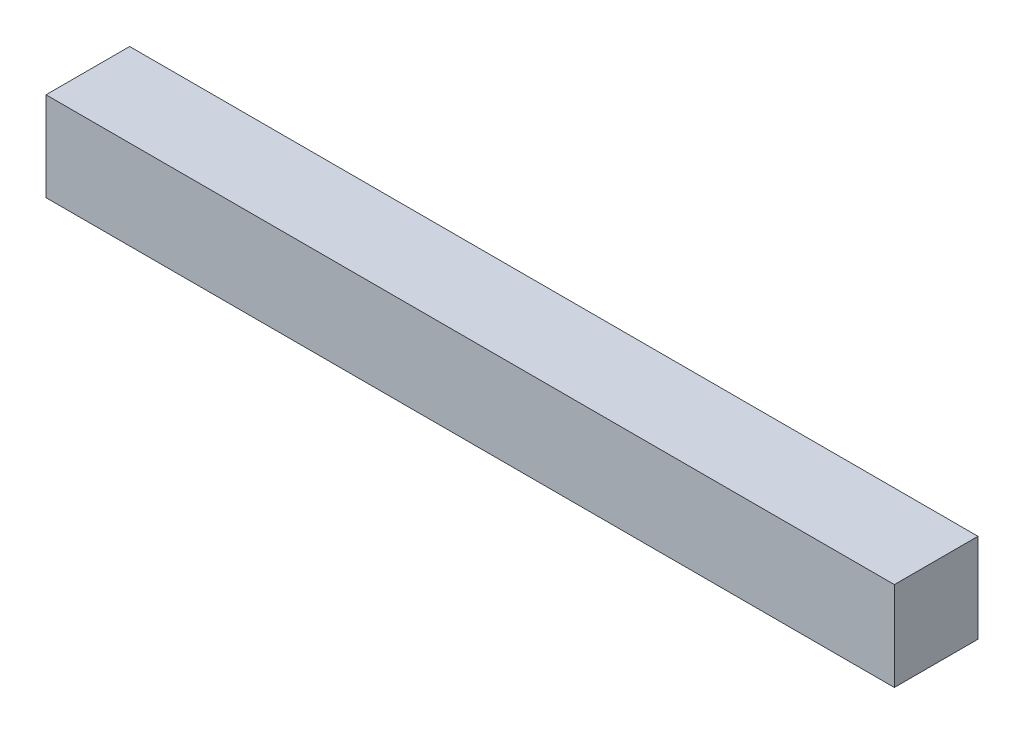
from build123d import *

# Parameters (mm, degrees)
CROQUIS1_W              = 50.72
CROQUIS1_H              = 5
SALIENTE_EXTRUIR1_DEPTH = 5.33


with BuildPart() as part:
    # Croquis1 → Saliente-Extruir1 (new body)
    with BuildSketch(Plane(origin=(0, 0, 0), x_dir=(1, 0, 0), z_dir=(0, 1, 0))):
        Rectangle(CROQUIS1_W, CROQUIS1_H)
    extrude(amount=SALIENTE_EXTRUIR1_DEPTH)


solid = part.part
